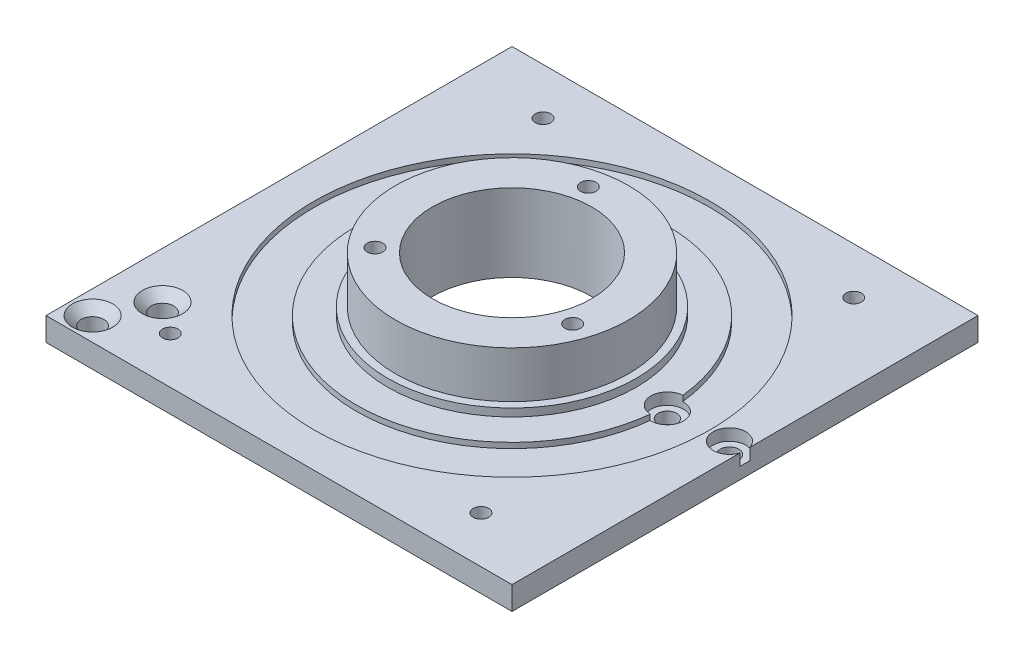
from build123d import *

# Parameters (mm, degrees)
SKETCH1_W                                      = 60
SKETCH1_H                                      = 60
BOSS_EXTRUDE1_DEPTH                            = 3
SKETCH3_R                                      = 1
CUT_EXTRUDE3_DEPTH                             = 43.532340636
SKETCH5_R                                      = 10.25
CUT_EXTRUDE4_DEPTH                             = 43.532340636
SKETCH6_R                                      = 16
SKETCH6_R_2                                    = 10.25
BOSS_EXTRUDE2_DEPTH                            = 1
SKETCH7_R                                      = 15
SKETCH7_R_2                                    = 10.25
BOSS_EXTRUDE3_DEPTH                            = 7
SKETCH10_R                                     = 1.45
STOP_MOUNT_D2P9_THROUGH_DEPTH                  = 3.01
SKETCH11_R                                     = 2.6
STOP_MOUNT_CSK_D5P2_90DEG_DEPTH                = 1.15
STOP_MOUNT_CSK_D5P2_90DEG_DRAFT                = -45
STOP_MOUNT_CSK_D5P2_90DEG_PROFILE_2_DEPTH      = 1.15
STOP_MOUNT_CSK_D5P2_90DEG_PROFILE_2_DRAFT      = -45
SKETCH13_R                                     = 1.45
YTAB_D2P9_DEPTH                                = 3.01
SKETCH14_R                                     = 1.2
GUIDEBLOCK1_D2P4_DEPTH                         = 3.01
SKETCH15_R                                     = 2.1
GUIDEBLOCK1_HEADCOUNTERBORE_D4P2_DEPTH         = 1.5
SKETCH16_R                                     = 25.5
SKETCH16_R_2                                   = 20
ROTATING_RETAINER_HEAD_CLEARANCE_ANNULUS_DEPTH = 0.7
SKETCH17_R                                     = 1
INNER_RETAINER_M2_TAPPED_ENVELOPE_DEPTH        = 4.3
SKETCH18_R                                     = 1.46
YTAB_THROUGH_HOLE_BACKING_RESTORATION_DEPTH    = 3
SKETCH19_R                                     = 1.25
YTAB_BLIND_M2P5_THREAD_ENVELOPES_DEPTH         = 2.6


with BuildPart() as part:
    # Sketch1 → Boss-Extrude1 (new body)
    with BuildSketch(Plane(origin=(0, 0, 0), x_dir=(1, 0, 0), z_dir=(0, 1, 0))):
        Rectangle(SKETCH1_W, SKETCH1_H)
    extrude(amount=BOSS_EXTRUDE1_DEPTH)

    # Sketch3 → Cut-Extrude3 (cut, through all)
    with BuildSketch(Plane(origin=(0, 3, 0), x_dir=(1, 0, 0), z_dir=(0, 1, 0))):
        with Locations(Location((-20, 24, 0), (0, 0, 270))):
            Circle(SKETCH3_R)
        with Locations(Location((20, 24, 0), (0, 0, 270))):
            Circle(SKETCH3_R)
        with Locations(Location((-20, -24, 0), (0, 0, 270))):
            Circle(SKETCH3_R)
        with Locations(Location((20, -24, 0), (0, 0, 270))):
            Circle(SKETCH3_R)
    extrude(amount=-CUT_EXTRUDE3_DEPTH, mode=Mode.SUBTRACT)

    # Sketch5 → Cut-Extrude4 (cut, through all)
    with BuildSketch(Plane.XZ):
        with Locations(Location((0, 0, 0), (0, 0, 270))):
            Circle(SKETCH5_R)
    extrude(amount=-CUT_EXTRUDE4_DEPTH, mode=Mode.SUBTRACT)

    # Sketch6 → Boss-Extrude2 (add)
    with BuildSketch(Plane(origin=(0, 3, 0), x_dir=(1, 0, 0), z_dir=(0, 1, 0))):
        with Locations(Location((0, 0, 0), (0, 0, 270))):
            Circle(SKETCH6_R)
        with Locations(Location((0, 0, 0), (0, 0, 90))):
            Circle(SKETCH6_R_2, mode=Mode.SUBTRACT)
    extrude(amount=BOSS_EXTRUDE2_DEPTH)

    # Sketch7 → Boss-Extrude3 (add)
    with BuildSketch(Plane(origin=(0, 3, 0), x_dir=(1, 0, 0), z_dir=(0, 1, 0))):
        with Locations(Location((0, 0, 0), (0, 0, 270))):
            Circle(SKETCH7_R)
        with Locations(Location((0, 0, 0), (0, 0, 90))):
            Circle(SKETCH7_R_2, mode=Mode.SUBTRACT)
    extrude(amount=BOSS_EXTRUDE3_DEPTH)

    # Sketch10 → Stop_Mount_D2p9_Through (cut)
    with BuildSketch(Plane(origin=(0, 3, 0), x_dir=(1, 0, 0), z_dir=(0, 1, 0))):
        with Locations(Location((-24, -21, 0), (0, 0, 270))):
            Circle(SKETCH10_R)
        with Locations(Location((-27, -27, 0), (0, 0, 270))):
            Circle(SKETCH10_R)
    extrude(amount=-STOP_MOUNT_D2P9_THROUGH_DEPTH, mode=Mode.SUBTRACT)


with BuildPart() as stop_mount_csk_d5p2_90deg_tool:
    # Sketch11 → Stop_Mount_CSK_D5p2_90deg (with draft: the straight prism first)
    with BuildSketch(Plane(origin=(0, 3, 0), x_dir=(1, 0, 0), z_dir=(0, 1, 0))):
        with Locations((-24, -21)):
            Circle(SKETCH11_R)
    extrude(amount=-STOP_MOUNT_CSK_D5P2_90DEG_DEPTH)
    # Stop_Mount_CSK_D5p2_90deg: the draft: its side faces are tilted about the plane it starts from
    stop_mount_csk_d5p2_90deg_sides = [stop_mount_csk_d5p2_90deg_tool.faces().sort_by_distance(p)[0] for p in [
        (-26.6, 2.425, 21),
    ]]
    draft(stop_mount_csk_d5p2_90deg_sides, Plane(origin=(0, 3, 0), x_dir=(1, 0, 0), z_dir=(0, 1, 0)), STOP_MOUNT_CSK_D5P2_90DEG_DRAFT)


with BuildPart() as part_1:
    add(part.part)

    # Stop_Mount_CSK_D5p2_90deg: cut by stop_mount_csk_d5p2_90deg_tool
    add(stop_mount_csk_d5p2_90deg_tool.part, mode=Mode.SUBTRACT)


with BuildPart() as stop_mount_csk_d5p2_90deg_profile_2_tool:
    # Sketch11 → Stop_Mount_CSK_D5p2_90deg profile 2 (with draft: the straight prism first)
    with BuildSketch(Plane(origin=(0, 3, 0), x_dir=(1, 0, 0), z_dir=(0, 1, 0))):
        with Locations((-27, -27)):
            Circle(SKETCH11_R)
    extrude(amount=-STOP_MOUNT_CSK_D5P2_90DEG_PROFILE_2_DEPTH)
    # Stop_Mount_CSK_D5p2_90deg profile 2: the draft: its side faces are tilted about the plane it starts from
    stop_mount_csk_d5p2_90deg_profile_2_sides = [stop_mount_csk_d5p2_90deg_profile_2_tool.faces().sort_by_distance(p)[0] for p in [
        (-29.6, 2.425, 27),
    ]]
    draft(stop_mount_csk_d5p2_90deg_profile_2_sides, Plane(origin=(0, 3, 0), x_dir=(1, 0, 0), z_dir=(0, 1, 0)), STOP_MOUNT_CSK_D5P2_90DEG_PROFILE_2_DRAFT)


with BuildPart() as part_2:
    add(part_1.part)

    # Stop_Mount_CSK_D5p2_90deg profile 2: cut by stop_mount_csk_d5p2_90deg_profile_2_tool
    add(stop_mount_csk_d5p2_90deg_profile_2_tool.part, mode=Mode.SUBTRACT)

    # Sketch13 → YTab_D2p9 (cut)
    with BuildSketch(Plane.XZ):
        with Locations(Location((27, -23, 0), (0, 0, 270))):
            Circle(SKETCH13_R)
        with Locations(Location((27, -17, 0), (0, 0, 270))):
            Circle(SKETCH13_R)
    extrude(amount=-YTAB_D2P9_DEPTH, mode=Mode.SUBTRACT)

    # Sketch14 → GuideBlock1_D2p4 (cut)
    with BuildSketch(Plane(origin=(0, 3, 0), x_dir=(1, 0, 0), z_dir=(0, 1, 0))):
        with Locations(Location((28, 0, 0), (0, 0, 270))):
            Circle(SKETCH14_R)
        with Locations(Location((20, 0, 0), (0, 0, 270))):
            Circle(SKETCH14_R)
    extrude(amount=-GUIDEBLOCK1_D2P4_DEPTH, mode=Mode.SUBTRACT)

    # Sketch15 → GuideBlock1_HeadCounterbore_D4p2 (cut)
    with BuildSketch(Plane(origin=(0, 3, 0), x_dir=(1, 0, 0), z_dir=(0, 1, 0))):
        with Locations((28, 0)):
            Circle(SKETCH15_R)
        with Locations(Location((20, 0, 0), (0, 0, 270))):
            Circle(SKETCH15_R)
    extrude(amount=-GUIDEBLOCK1_HEADCOUNTERBORE_D4P2_DEPTH, mode=Mode.SUBTRACT)

    # Sketch16 → Rotating_Retainer_Head_Clearance_Annulus (cut)
    with BuildSketch(Plane(origin=(0, 3, 0), x_dir=(1, 0, 0), z_dir=(0, 1, 0))):
        with Locations(Location((0, 0, 0), (0, 0, 270))):
            Circle(SKETCH16_R)
        Circle(SKETCH16_R_2, mode=Mode.SUBTRACT)
    extrude(amount=-ROTATING_RETAINER_HEAD_CLEARANCE_ANNULUS_DEPTH, mode=Mode.SUBTRACT)

    # Sketch17 → Inner_Retainer_M2_Tapped_Envelope (cut)
    with BuildSketch(Plane(origin=(0, 10, 0), x_dir=(1, 0, 0), z_dir=(0, 1, 0))):
        with Locations(Location((-9.399263552, -8.240378916, 0), (0, 0, 270))):
            Circle(SKETCH17_R)
        with Locations(Location((-2.436745703, 12.260190471, 0), (0, 0, 270))):
            Circle(SKETCH17_R)
        with Locations(Location((11.836009254, -4.019811554, 0), (0, 0, 270))):
            Circle(SKETCH17_R)
    extrude(amount=-INNER_RETAINER_M2_TAPPED_ENVELOPE_DEPTH, mode=Mode.SUBTRACT)

    # Sketch18 → YTab_Through_Hole_Backing_Restoration (add)
    with BuildSketch(Plane.XZ):
        with Locations((27, -23)):
            Circle(SKETCH18_R)
        with Locations((27, -17)):
            Circle(SKETCH18_R)
    extrude(amount=-YTAB_THROUGH_HOLE_BACKING_RESTORATION_DEPTH)

    # Sketch19 → YTab_Blind_M2p5_Thread_Envelopes (cut)
    with BuildSketch(Plane.XZ):
        with Locations(Location((27, -23, 0), (0, 0, 270))):
            Circle(SKETCH19_R)
        with Locations(Location((27, -17, 0), (0, 0, 270))):
            Circle(SKETCH19_R)
    extrude(amount=-YTAB_BLIND_M2P5_THREAD_ENVELOPES_DEPTH, mode=Mode.SUBTRACT)


solid = part_2.part
